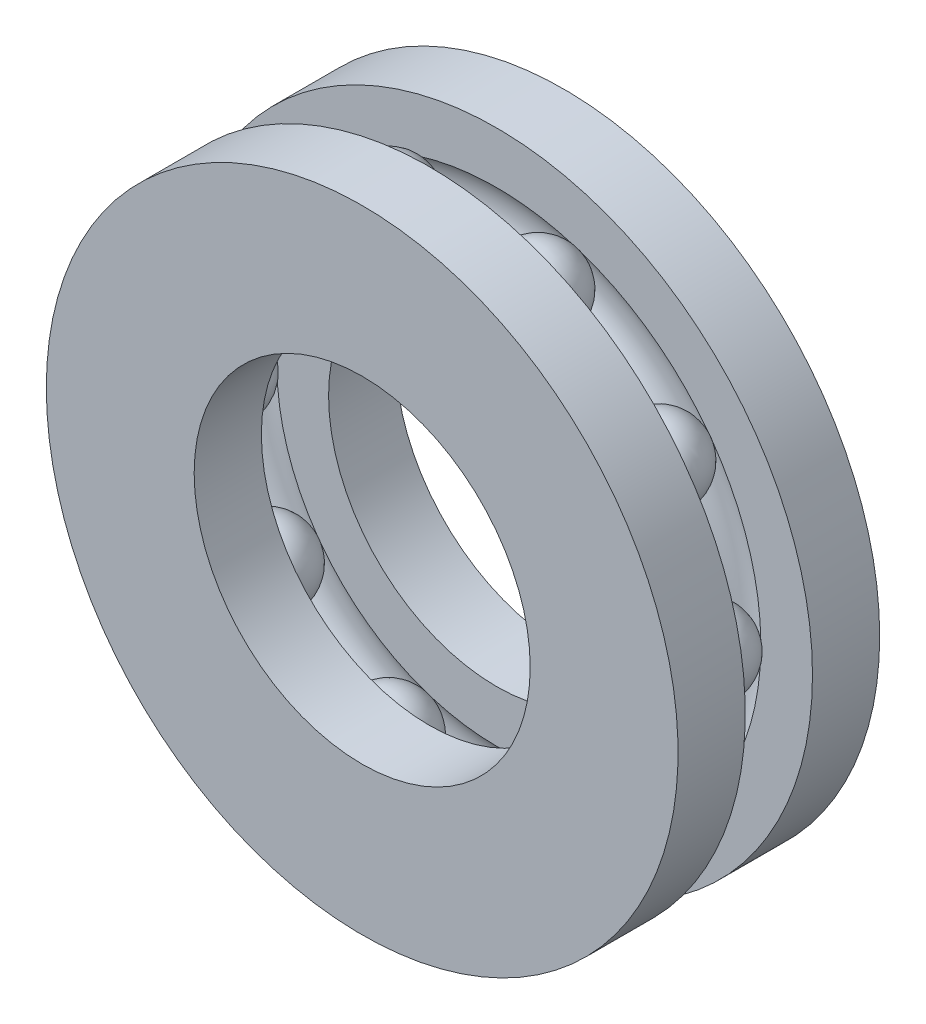
from build123d import *

# Parameters (mm, degrees)
SKETCH1_R           = 23.5
SKETCH1_R_2         = 12.5
BOSS_EXTRUDE1_DEPTH = 5
SKETCH3_R           = 23.5
SKETCH3_R_2         = 12.5
BOSS_EXTRUDE2_DEPTH = 5
SKETCH2_R           = 3
CIRPATTERN6_COUNT   = 10


with BuildPart() as part:
    # Sketch1 → Boss-Extrude1 (new body)
    with BuildSketch(Plane.XY):
        Circle(SKETCH1_R)
        Circle(SKETCH1_R_2, mode=Mode.SUBTRACT)
    extrude(amount=BOSS_EXTRUDE1_DEPTH)


with BuildPart() as body_2:
    # Sketch3 → Boss-Extrude2 (new body)
    with BuildSketch(Plane(origin=(0, 0, 15), x_dir=(-1, 0, 0), z_dir=(0, 0, -1))):
        Circle(SKETCH3_R)
        Circle(SKETCH3_R_2, mode=Mode.SUBTRACT)
    extrude(amount=BOSS_EXTRUDE2_DEPTH)


with BuildPart() as cut_revolve1_tool:
    # Sketch2 → Cut-Revolve1 (revolve)
    with BuildSketch(Plane(origin=(0, 0, 0), x_dir=(1, 0, 0), z_dir=(0, 1, 0))):
        with Locations((-18, -7.5)):
            Circle(SKETCH2_R)
    revolve(axis=Axis((0, 0, 0), (0, 0, 1)))


with BuildPart() as part_1:
    add(part.part)

    # Cut-Revolve1: cut by cut_revolve1_tool
    add(cut_revolve1_tool.part, mode=Mode.SUBTRACT)


with BuildPart() as body_2_1:
    add(body_2.part)

    # Cut-Revolve1: cut by cut_revolve1_tool
    add(cut_revolve1_tool.part, mode=Mode.SUBTRACT)


with BuildPart() as body_3:
    # Sketch4 → Revolve1 (revolve)
    with BuildSketch(Plane(origin=(0, 0, 0), x_dir=(1, 0, 0), z_dir=(0, 1, 0))):
        with BuildLine():
            Line((-18, -10.51), (-18, -4.49))
            ThreePointArc((-18, -4.49), (-21.01, -7.5), (-18, -10.51))
        make_face()
    revolve1 = revolve(axis=Axis((-18, 0, 9.678831593), (0, 0, -1)))


with BuildPart() as part_2:
    add(part_1.part)

    add(body_2_1.part)  # CirPattern6 merges body 2
    # CirPattern6: Revolve1 ×10 about axis
    cirpattern6_axis = Axis((0, 0, 0), (0, 0, 1))
    for i in range(1, CIRPATTERN6_COUNT):
        add(revolve1.rotate(cirpattern6_axis, i * 360 / CIRPATTERN6_COUNT))


solid = Compound([body_3.part, part_2.part])
